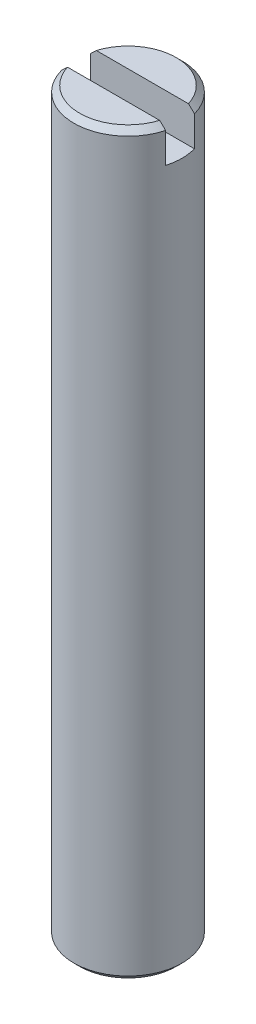
from build123d import *

# Parameters (mm, degrees)
SKETCH1_R           = 187.5
BOSS_EXTRUDE1_DEPTH = 2563
SKETCH2_W           = 375
SKETCH2_H           = 100
CUT_EXTRUDE1_DEPTH  = 125
CHAMFER1_SIZE       = 20
CHAMFER2_SIZE       = 20


with BuildPart() as part:
    # Sketch1 → Boss-Extrude1 (new body)
    with BuildSketch(Plane(origin=(0, 0, 0), x_dir=(1, 0, 0), z_dir=(0, 1, 0))):
        with Locations(Location((0, 0, 0), (0, 0, 270))):
            Circle(SKETCH1_R)
    extrude(amount=BOSS_EXTRUDE1_DEPTH)

    # Sketch2 → Cut-Extrude1 (cut)
    with BuildSketch(Plane(origin=(0, 2563, 0), x_dir=(1, 0, 0), z_dir=(0, 1, 0))):
        Rectangle(SKETCH2_W, SKETCH2_H)
    extrude(amount=-CUT_EXTRUDE1_DEPTH, mode=Mode.SUBTRACT)

    # Chamfer1
    chamfer1_edges = [part.edges().sort_by_distance(p)[0] for p in [
        (0, 2563, -187.5),
        (113.536888279, 2563, 149.216704829),
    ]]
    chamfer(chamfer1_edges, length=CHAMFER1_SIZE)

    # Chamfer2
    chamfer2_edges = [part.edges().sort_by_distance(p)[0] for p in [
        (0, 0, -187.5),
    ]]
    chamfer(chamfer2_edges, length=CHAMFER2_SIZE)


solid = part.part
